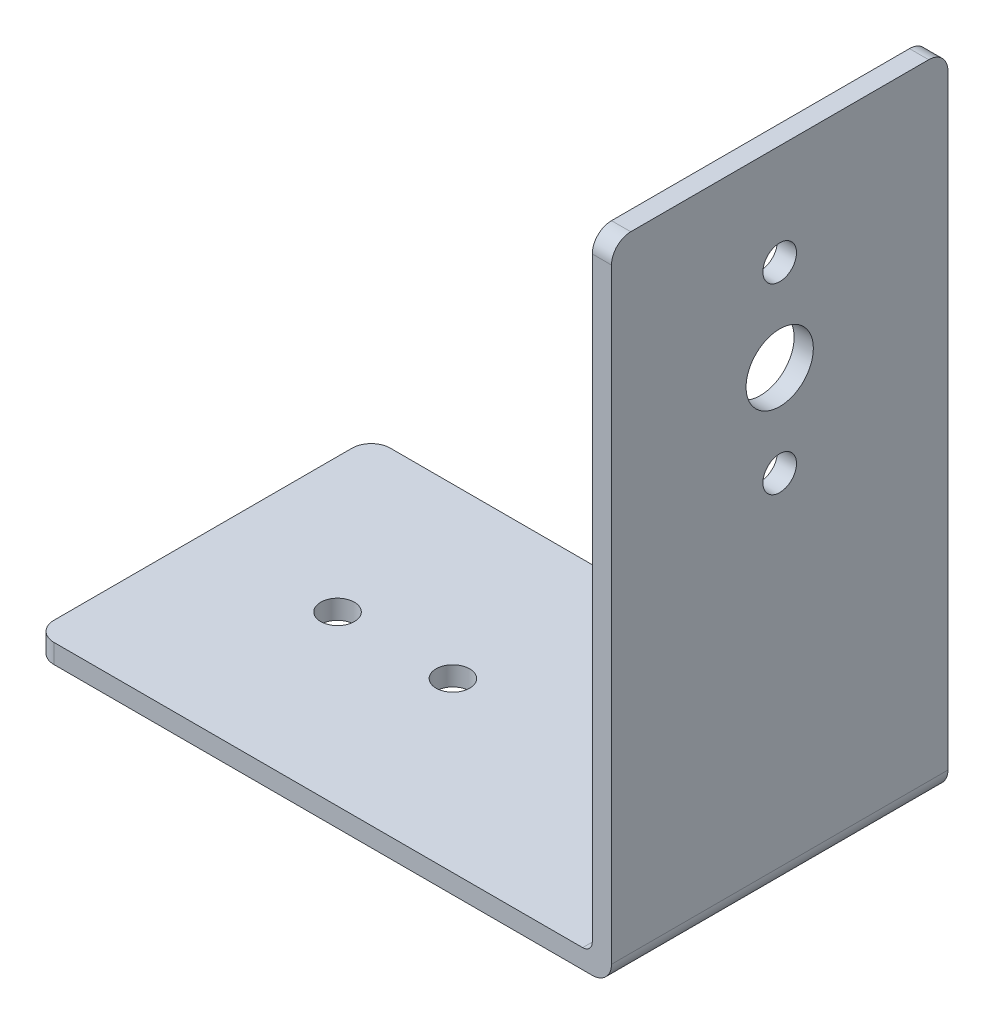
from build123d import *

# Parameters (mm, degrees)
EXTRU_MINCE1_DEPTH      = 35
CONG_1_R                = 2
CONG_3_R                = 1
ESQUISSE3_R             = 1.75
ESQUISSE3_R_2           = 3.5
ENL_V_MAT_EXTRU_2_DEPTH = 2
CONG_5_R                = 2
CONG_6_R                = 2
CONG_7_R                = 2
CONG_8_R                = 2
ESQUISSE4_R             = 1.75
ENL_V_MAT_EXTRU_3_DEPTH = 2


with BuildPart() as part:
    # Esquisse1 → Extru.-Mince1 (new body)
    with BuildSketch(Plane.XY):
        Polygon((0, 0), (58, 0), (58, 65), (60, 65), (60, -2), (0, -2), align=None)
    extrude(amount=EXTRU_MINCE1_DEPTH)

    # Congé1
    cong_1_edges = [part.edges().sort_by_distance(p)[0] for p in [
        (60, -2, 17.5),
    ]]
    fillet(cong_1_edges, radius=CONG_1_R)

    # Congé3
    cong_3_edges = [part.edges().sort_by_distance(p)[0] for p in [
        (58, 0, 17.5),
    ]]
    fillet(cong_3_edges, radius=CONG_3_R)

    # Esquisse3 → Enlèv. mat.-Extru.2 (cut)
    with BuildSketch(Plane(origin=(60, 0, 0), x_dir=(0, 0, -1), z_dir=(1, 0, 0))):
        with Locations((-17.5, 35.5)):
            Circle(ESQUISSE3_R)
        with Locations((-17.5, 54.5)):
            Circle(ESQUISSE3_R)
        with Locations((-17.5, 45)):
            Circle(ESQUISSE3_R_2)
    extrude(amount=-ENL_V_MAT_EXTRU_2_DEPTH, mode=Mode.SUBTRACT)

    # Congé5
    cong_5_edges = [part.edges().sort_by_distance(p)[0] for p in [
        (59, 65, 35),
    ]]
    fillet(cong_5_edges, radius=CONG_5_R)

    # Congé6
    cong_6_edges = [part.edges().sort_by_distance(p)[0] for p in [
        (59, 65, 0),
    ]]
    fillet(cong_6_edges, radius=CONG_6_R)

    # Congé7
    cong_7_edges = [part.edges().sort_by_distance(p)[0] for p in [
        (0, -1, 0),
    ]]
    fillet(cong_7_edges, radius=CONG_7_R)

    # Congé8
    cong_8_edges = [part.edges().sort_by_distance(p)[0] for p in [
        (0, -1, 35),
    ]]
    fillet(cong_8_edges, radius=CONG_8_R)

    # Esquisse4 → Enlèv. mat.-Extru.3 (cut)
    with BuildSketch(Plane(origin=(0, 0, 0), x_dir=(1, 0, 0), z_dir=(0, 1, 0))):
        with Locations(Location((26, -17.5, 0), (0, 0, 270))):
            Circle(ESQUISSE4_R)
        with Locations(Location((14, -17.5, 0), (0, 0, 270))):
            Circle(ESQUISSE4_R)
    extrude(amount=-ENL_V_MAT_EXTRU_3_DEPTH, mode=Mode.SUBTRACT)


solid = part.part
